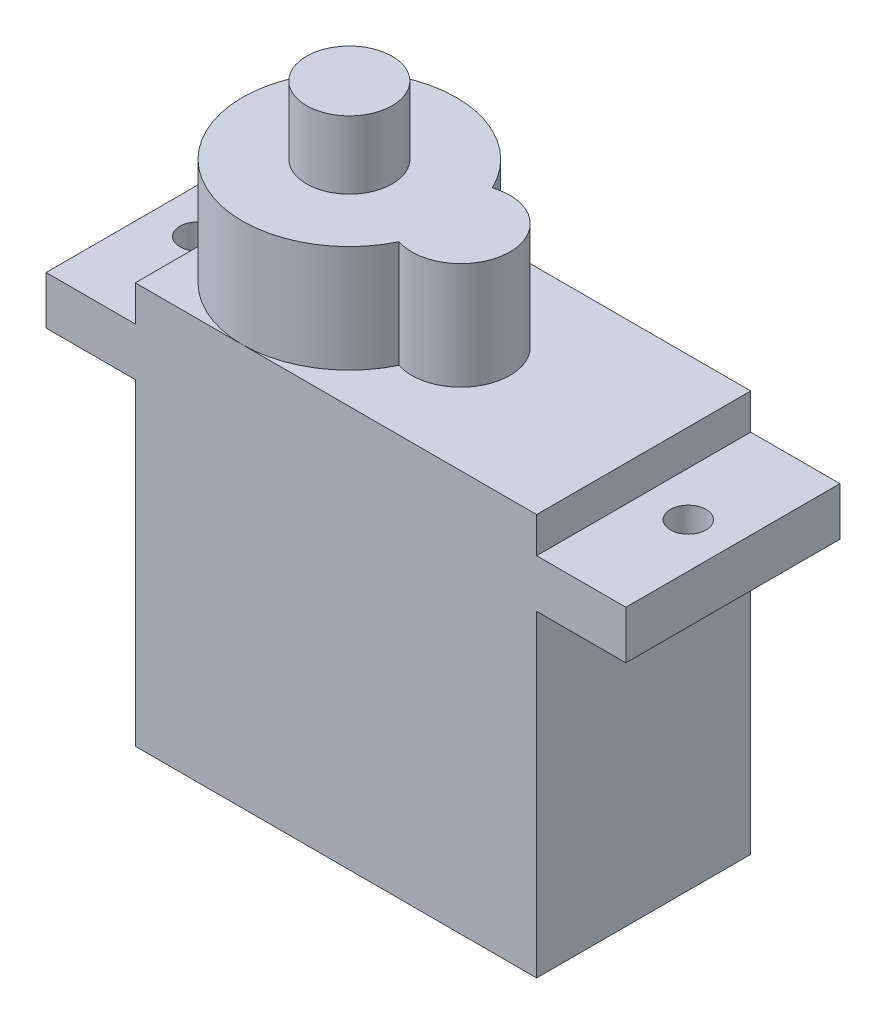
from build123d import *

# Parameters (mm, degrees)
SKETCH_1_W                      = 22.5
SKETCH_1_H                      = 22.5
EXTRUDE_1_DEPTH                 = 12
SKETCH_2_W                      = 12
SKETCH_2_H                      = 2.7
EXTRUDE_2_DEPTH                 = 5
CUT_EXTRUDE_1_REACH             = 30.78
SKETCH_4_R                      = 1
CUT_EXTRUDE_1_DIRECTION_2_DEPTH = 29.78041869
EXTRUDE_3_DEPTH                 = 6
SKETCH_6_R                      = 2.4
EXTRUDE_4_DEPTH                 = 3.8


with BuildPart() as part:
    # 草图1 → 凸台-拉伸1 (new body)
    with BuildSketch(Plane.XY):
        Rectangle(SKETCH_1_W, SKETCH_1_H)
    extrude(amount=-EXTRUDE_1_DEPTH)

    # 草图2 → 凸台-拉伸2 (add)
    with BuildSketch(Plane(origin=(11.25, 0, 0), x_dir=(0, 0, -1), z_dir=(1, 0, 0))):
        with Locations((6, 7.9)):
            Rectangle(SKETCH_2_W, SKETCH_2_H)
    extrude(amount=EXTRUDE_2_DEPTH)

    # 草图4 → 切除-拉伸1 (cut, up to next)
    with BuildSketch(Plane(origin=(0, 9.25, 0), x_dir=(1, 0, 0), z_dir=(0, 1, 0)), mode=Mode.PRIVATE) as cut_extrude_1_sk1:
        with Locations(Location((13.75, 6, 0), (0, 0, 90))):
            Circle(SKETCH_4_R)
    cut_extrude_1_tool1 = extrude(cut_extrude_1_sk1.sketch, amount=-CUT_EXTRUDE_1_REACH, mode=Mode.PRIVATE) & part.part
    add(cut_extrude_1_tool1.solids().sort_by_distance((13.75, 9.25, -6))[0], mode=Mode.SUBTRACT)

    # 草图4 → 切除-拉伸1 direction 2 (cut)
    with BuildSketch(Plane(origin=(0, 9.25, 0), x_dir=(1, 0, 0), z_dir=(0, 1, 0))):
        with Locations(Location((13.75, 6, 0), (0, 0, 90))):
            Circle(SKETCH_4_R)
    extrude(amount=CUT_EXTRUDE_1_DIRECTION_2_DEPTH, mode=Mode.SUBTRACT)

    # 镜向1: part across plane


with BuildPart() as part_1:
    add(part.part)
    add(part.part.mirror(Plane(origin=(0, 0, 0), x_dir=(0, 0, 1), z_dir=(1, 0, 0))))

    # 草图5 → 凸台-拉伸3 (add)
    with BuildSketch(Plane(origin=(0, 11.25, 0), x_dir=(1, 0, 0), z_dir=(0, 1, 0))):
        with BuildLine():
            ThreePointArc((0.15, 8.615339366), (-11.25, 6), (0.15, 3.384660634))
            ThreePointArc((0.15, 3.384660634), (3.75, 6), (0.15, 8.615339366))
        make_face()
    extrude(amount=EXTRUDE_3_DEPTH)

    # 草图6 → 凸台-拉伸4 (add)
    with BuildSketch(Plane(origin=(0, 17.25, 0), x_dir=(1, 0, 0), z_dir=(0, 1, 0))):
        with Locations((-5.25, 6)):
            Circle(SKETCH_6_R)
    extrude(amount=EXTRUDE_4_DEPTH)


solid = part_1.part
